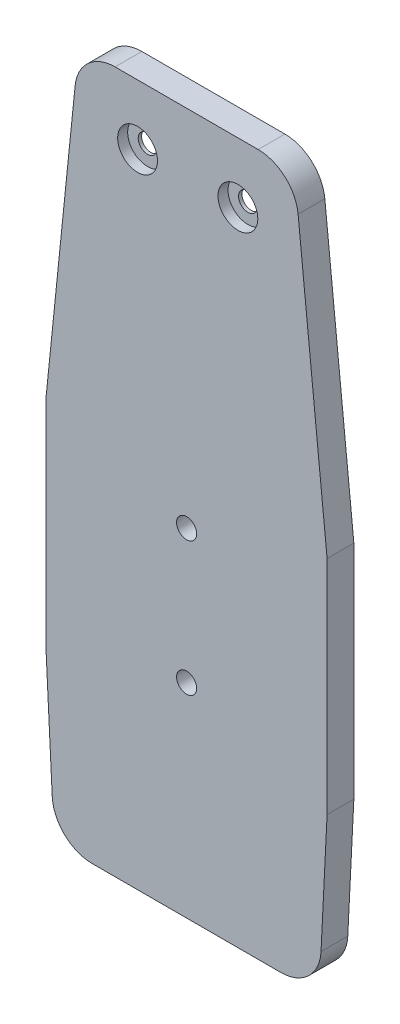
from build123d import *

# Parameters (mm, degrees)
BOSS_EXTRUDE4_DEPTH                                 = 2
BOSS_EXTRUDE5_START                                 = 2
BOSS_EXTRUDE5_DEPTH                                 = 2
BOSS_EXTRUDE6_DEPTH                                 = 2
FILLET1_R                                           = 2
CBORE_FOR_3_BINDING_HEAD_MACHINE_SCREW1_D           = 2.794
CBORE_FOR_3_BINDING_HEAD_MACHINE_SCREW1_CBORE_D     = 5.95376
CBORE_FOR_3_BINDING_HEAD_MACHINE_SCREW1_CBORE_DEPTH = 1.4986
SKETCH10_R                                          = 1.5
CUT_EXTRUDE1_DEPTH                                  = 5
SKETCH9_R                                           = 1.5
CUT_EXTRUDE2_DEPTH                                  = 5


with BuildPart() as part:
    # Sketch1 → Boss-Extrude4 (new body)
    with BuildSketch(Plane.XY):
        with BuildLine():
            Line((37.090015594, -18.299625702), (38, -0.099937578))
            Line((38, -0.099937578), (38, 33.052037892))
            Line((38, 33.052037892), (33.662977857, 75.458476622))
            ThreePointArc((33.662977857, 75.458476622), (31.715138161, 79.301265628), (27.694112953, 80.84802453))
            Line((27.694112953, 80.84802453), (6.305887047, 80.84802453))
            ThreePointArc((6.305887047, 80.84802453), (2.284861839, 79.301265628), (0.337022143, 75.458476622))
            Line((0.337022143, 75.458476622), (-4, 33.052037892))
            Line((-4, 33.052037892), (-4, -0.099937578))
            Line((-4, -0.099937578), (-3.090015594, -18.299625702))
            ThreePointArc((-3.090015594, -18.299625702), (-1.232851956, -22.347283877), (2.902498439, -24))
            Line((2.902498439, -24), (31.097501561, -24))
            ThreePointArc((31.097501561, -24), (35.232851956, -22.347283877), (37.090015594, -18.299625702))
        make_face()
    extrude(amount=BOSS_EXTRUDE4_DEPTH)

    # Sketch5 → Boss-Extrude5 (add)
    with BuildSketch(Plane(origin=(0, 0, 0), x_dir=(-1, 0, 0), z_dir=(0, 0, -1)).offset(BOSS_EXTRUDE5_START)):
        with BuildLine():
            Line((-33.662977857, 75.458476622), (-38, 33.052037892))
            Line((-38, 33.052037892), (-38, -0.099937578))
            Line((-38, -0.099937578), (-37.090015594, -18.299625702))
            ThreePointArc((-37.090015594, -18.299625702), (-35.232851956, -22.347283877), (-31.097501561, -24))
            Line((-31.097501561, -24), (-2.902498439, -24))
            ThreePointArc((-2.902498439, -24), (1.232851956, -22.347283877), (3.090015594, -18.299625702))
            Line((3.090015594, -18.299625702), (4, -0.099937578))
            Line((4, -0.099937578), (4, 33.052037892))
            Line((4, 33.052037892), (-0.337022143, 75.458476622))
            ThreePointArc((-0.337022143, 75.458476622), (-2.284861839, 79.301265628), (-6.305887047, 80.84802453))
            Line((-6.305887047, 80.84802453), (-27.694112953, 80.84802453))
            ThreePointArc((-27.694112953, 80.84802453), (-31.715138161, 79.301265628), (-33.662977857, 75.458476622))
        make_face()
        with BuildLine():
            Line((-31.097501561, -22), (-2.902498439, -22))
            ThreePointArc((-2.902498439, -22), (-0.145598176, -20.898189251), (1.092510916, -18.199750468))
            Line((1.092510916, -18.199750468), (2, -0.049968789))
            Line((2, -0.049968789), (2, 32.950031211))
            Line((2, 32.950031211), (-2.326643778, 75.254992592))
            ThreePointArc((-2.326643778, 75.254992592), (-3.625203575, 77.816851929), (-6.305887047, 78.84802453))
            Line((-6.305887047, 78.84802453), (-27.694112953, 78.84802453))
            ThreePointArc((-27.694112953, 78.84802453), (-30.374796425, 77.816851929), (-31.673356222, 75.254992592))
            Line((-31.673356222, 75.254992592), (-36, 32.950031211))
            Line((-36, 32.950031211), (-36, -0.049968789))
            Line((-36, -0.049968789), (-35.092510916, -18.199750468))
            ThreePointArc((-35.092510916, -18.199750468), (-33.854401824, -20.898189251), (-31.097501561, -22))
        make_face(mode=Mode.SUBTRACT)
    extrude(amount=-BOSS_EXTRUDE5_DEPTH)

    # Sketch6 → Boss-Extrude6 (add)
    with BuildSketch(Plane(origin=(0, 0, 0), x_dir=(-1, 0, 0), z_dir=(0, 0, -1))):
        with BuildLine():
            Line((-30.625, 65.84802453), (-3.375, 65.84802453))
            Line((-3.375, 65.84802453), (0, 32.84802453))
            Line((0, 32.84802453), (0, 0))
            Line((0, 0), (-0.904993762, -18.099875234))
            ThreePointArc((-0.904993762, -18.099875234), (-1.524048308, -19.449094626), (-2.902498439, -20))
            Line((-2.902498439, -20), (-31.097501561, -20))
            ThreePointArc((-31.097501561, -20), (-32.475951692, -19.449094626), (-33.095006238, -18.099875234))
            Line((-33.095006238, -18.099875234), (-34, 0))
            Line((-34, 0), (-34, 32.84802453))
            Line((-34, 32.84802453), (-30.625, 65.84802453))
        make_face()
    extrude(amount=BOSS_EXTRUDE6_DEPTH)

    # Fillet1
    fillet1_edges = [part.edges().sort_by_distance(p)[0] for p in [
        (30.625, 65.84802453, -1),
        (3.375, 65.84802453, -1),
    ]]
    fillet(fillet1_edges, radius=FILLET1_R)

    # CBORE for #3 Binding Head Machine Screw1 (through all)
    with Locations(Plane.XY.offset(2)):
        with Locations((24.663824929, 71.84802453), (9.664488304, 71.84802453)):
            CounterBoreHole(CBORE_FOR_3_BINDING_HEAD_MACHINE_SCREW1_D / 2, CBORE_FOR_3_BINDING_HEAD_MACHINE_SCREW1_CBORE_D / 2, CBORE_FOR_3_BINDING_HEAD_MACHINE_SCREW1_CBORE_DEPTH)

    # Sketch10 → Cut-Extrude1 (cut)
    with BuildSketch(Plane.XY.offset(2)):
        with Locations((17, 6.476050157)):
            Circle(SKETCH10_R)
    extrude(amount=-CUT_EXTRUDE1_DEPTH, mode=Mode.SUBTRACT)

    # Sketch9 → Cut-Extrude2 (cut)
    with BuildSketch(Plane.XY.offset(2)):
        with Locations((17, 6.476050157)):
            Circle(SKETCH9_R)
        with Locations((17, 26.476050157)):
            Circle(SKETCH9_R)
    extrude(amount=-CUT_EXTRUDE2_DEPTH, mode=Mode.SUBTRACT)


solid = part.part
